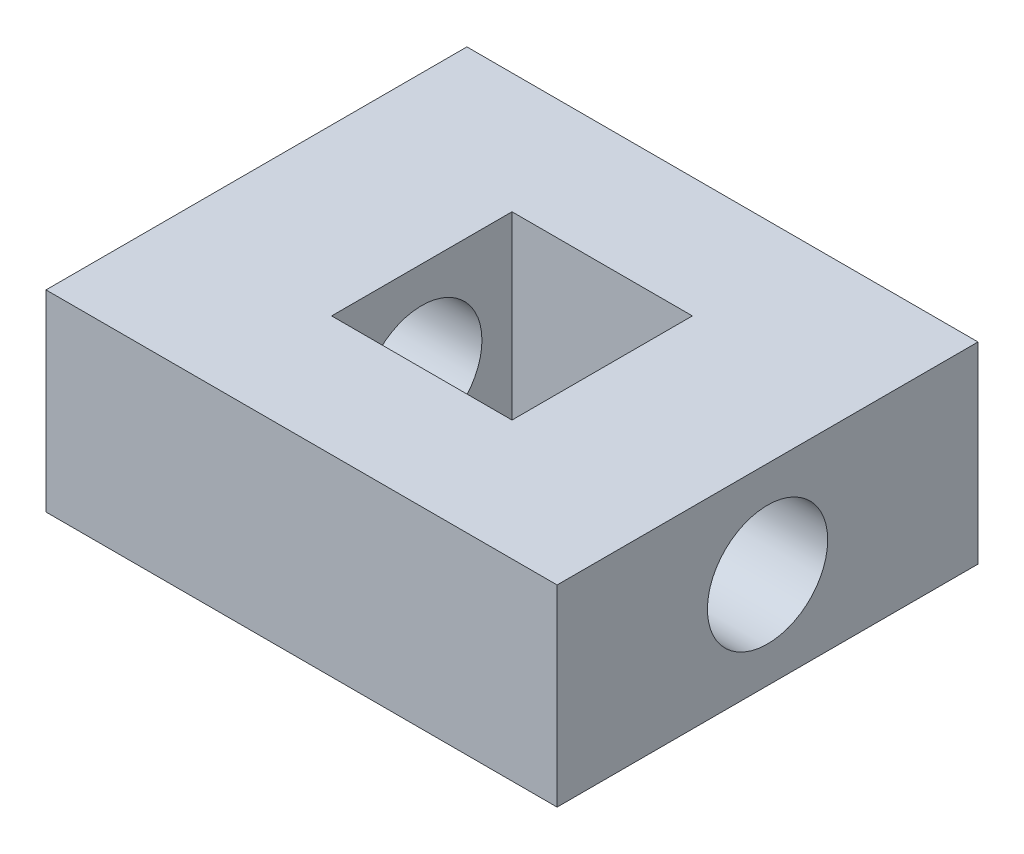
from build123d import *

# Parameters (mm, degrees)
SKETCH1_W               = 17
SKETCH1_H               = 14
SKETCH1_W_2             = 6
SKETCH1_H_2             = 6
BOSS_EXTRUDE1_DEPTH     = 3.2
CUT_EXTRUDE1_DEPTH      = 12.466908912
CUT_EXTRUDE1_DEPTH_BACK = 12.466908912
SKETCH2_R               = 2


with BuildPart() as part:
    # Sketch1 → Boss-Extrude1 (new, symmetric)
    with BuildSketch(Plane(origin=(0, 0, 0), x_dir=(1, 0, 0), z_dir=(0, 1, 0))):
        Rectangle(SKETCH1_W, SKETCH1_H)
        Rectangle(SKETCH1_W_2, SKETCH1_H_2, mode=Mode.SUBTRACT)
    extrude(amount=BOSS_EXTRUDE1_DEPTH, both=True)

    # Sketch2 → Cut-Extrude1 (cut, two sides: drawn at the far end of the back side and taken through both)
    with BuildSketch(Plane(origin=(0, 0, 0), x_dir=(0, 0, -1), z_dir=(1, 0, 0)).offset(-CUT_EXTRUDE1_DEPTH_BACK)):
        Circle(SKETCH2_R)
    extrude(amount=CUT_EXTRUDE1_DEPTH + CUT_EXTRUDE1_DEPTH_BACK, mode=Mode.SUBTRACT)


solid = part.part
